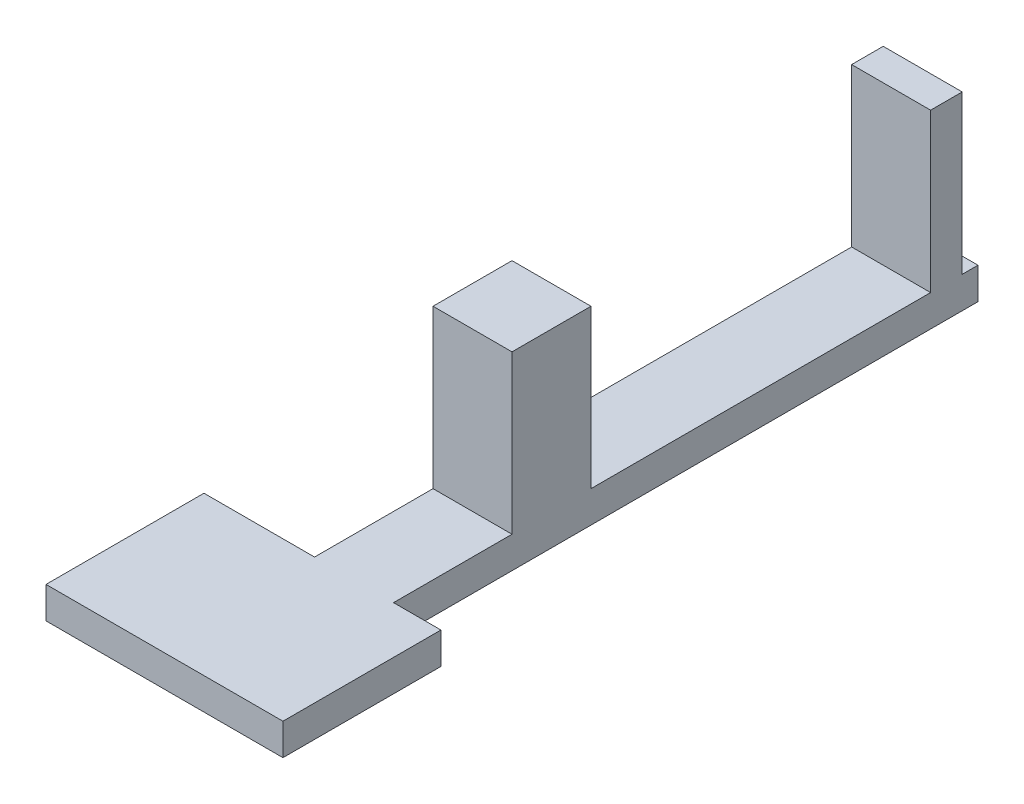
from build123d import *

# Parameters (mm, degrees)
SKETCH1_W           = 50
SKETCH1_H           = 20
BOSS_EXTRUDE1_DEPTH = 470
SKETCH2_W           = 150
SKETCH2_H           = 100
BOSS_EXTRUDE2_DEPTH = 20
SKETCH3_W           = 50
SKETCH3_H           = 20
SKETCH3_H_2         = 50
BOSS_EXTRUDE3_DEPTH = 100


with BuildPart() as part:
    # Sketch1 → Boss-Extrude1 (new body)
    with BuildSketch(Plane.XY):
        Rectangle(SKETCH1_W, SKETCH1_H)
    extrude(amount=BOSS_EXTRUDE1_DEPTH)

    # Sketch2 → Boss-Extrude2 (add)
    with BuildSketch(Plane(origin=(0, 10, 0), x_dir=(1, 0, 0), z_dir=(0, 1, 0))):
        with Locations((-20, -420)):
            Rectangle(SKETCH2_W, SKETCH2_H)
    extrude(amount=-BOSS_EXTRUDE2_DEPTH)

    # Sketch3 → Boss-Extrude3 (add)
    with BuildSketch(Plane(origin=(0, 10, 0), x_dir=(1, 0, 0), z_dir=(0, 1, 0))):
        with Locations((0, -20)):
            Rectangle(SKETCH3_W, SKETCH3_H)
        with Locations((0, -270)):
            Rectangle(SKETCH3_W, SKETCH3_H_2)
    extrude(amount=BOSS_EXTRUDE3_DEPTH)


solid = part.part
